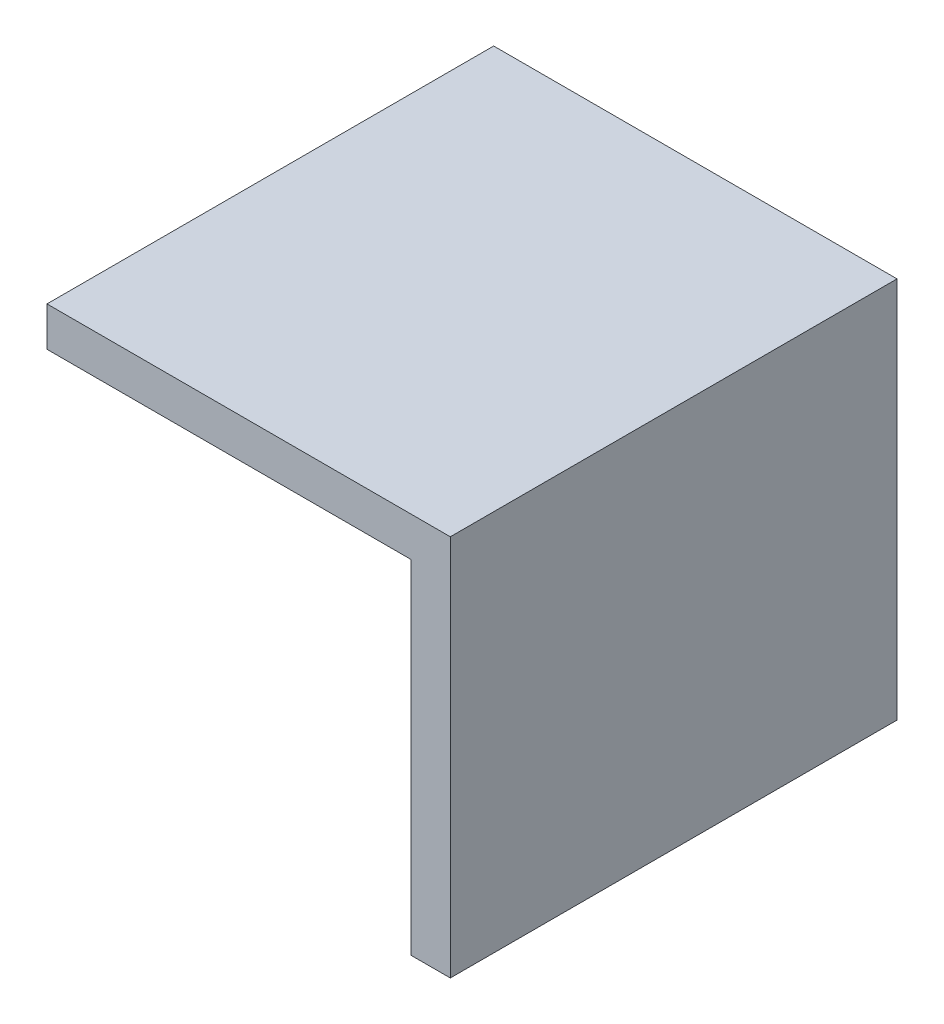
from build123d import *

# Parameters (mm, degrees)
SKETCH1_W           = 40
SKETCH1_H           = 44.3
BOSS_EXTRUDE1_DEPTH = 3.9
SKETCH2_W           = 3.9
SKETCH2_H           = 44.3
BOSS_EXTRUDE2_DEPTH = 33.996


with BuildPart() as part:
    # Sketch1 → Boss-Extrude1 (new body)
    with BuildSketch(Plane(origin=(0, 0, 0), x_dir=(1, 0, 0), z_dir=(0, 1, 0))):
        with Locations((20, 22.15)):
            Rectangle(SKETCH1_W, SKETCH1_H)
    extrude(amount=BOSS_EXTRUDE1_DEPTH)

    # Sketch2 → Boss-Extrude2 (add)
    with BuildSketch(Plane.XZ):
        with Locations((38.05, -22.15)):
            Rectangle(SKETCH2_W, SKETCH2_H)
    extrude(amount=BOSS_EXTRUDE2_DEPTH)


solid = part.part
